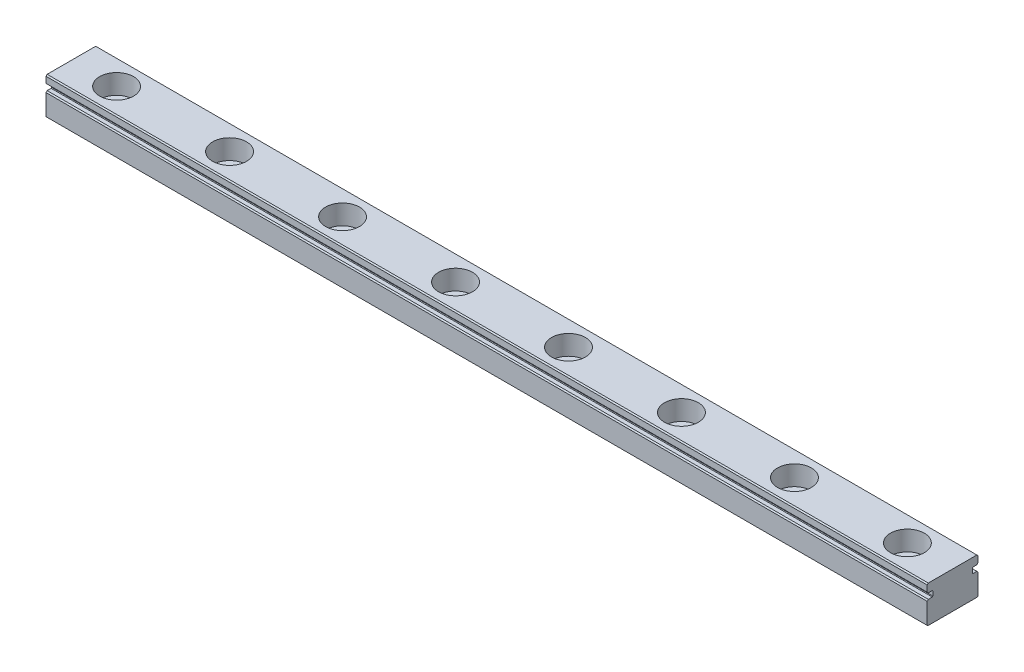
from build123d import *

# Parameters (mm, degrees)
EXTRUDE_1_DEPTH     = 156
CHAMFER_1_SIZE      = 0.2
CHAMFER_2_SIZE      = 0.1
SKETCH_2_R          = 1.6
CUT_EXTRUDE_1_DEPTH = 6.5
SKETCH_3_R          = 3
CUT_EXTRUDE_2_DEPTH = 3.5


with BuildPart() as part:
    # 草图1 → 凸台-拉伸1 (new body)
    with BuildSketch(Plane(origin=(0, 0, 0), x_dir=(0, 0, -1), z_dir=(1, 0, 0))):
        Polygon((-4.5, 1.5), (-3.5, 1.5), (-3.5, 0.5), (-4.5, 0.5), (-4.5, -3.5), (4.5, -3.5), (4.5, 0.5), (3.5, 0.5), (3.5, 1.5), (4.5, 1.5), (4.5, 3), (-4.5, 3), align=None)
    extrude(amount=EXTRUDE_1_DEPTH)

    # 倒角1
    chamfer_1_edges = [part.edges().sort_by_distance(p)[0] for p in [
        (78, 1.5, -4.5),
        (78, 0.5, -4.5),
        (78, 0.5, 4.5),
        (78, 1.5, 4.5),
        (78, 3, 4.5),
        (78, 3, -4.5),
    ]]
    chamfer(chamfer_1_edges, length=CHAMFER_1_SIZE)

    # 倒角2
    chamfer_2_edges = [part.edges().sort_by_distance(p)[0] for p in [
        (78, 1.5, -3.5),
        (78, 0.5, -3.5),
        (78, -3.5, -4.5),
        (78, -3.5, 4.5),
        (78, 0.5, 3.5),
        (78, 1.5, 3.5),
    ]]
    chamfer(chamfer_2_edges, length=CHAMFER_2_SIZE)

    # 草图2 → 切除-拉伸1 (cut)
    with BuildSketch(Plane(origin=(0, 3, 0), x_dir=(1, 0, 0), z_dir=(0, 1, 0))):
        with Locations(Location((8, 0, 0), (0, 0, 270))):
            Circle(SKETCH_2_R)
        with Locations(Location((28, 0, 0), (0, 0, 270))):
            Circle(SKETCH_2_R)
        with Locations(Location((48, 0, 0), (0, 0, 270))):
            Circle(SKETCH_2_R)
        with Locations(Location((68, 0, 0), (0, 0, 270))):
            Circle(SKETCH_2_R)
        with Locations(Location((88, 0, 0), (0, 0, 270))):
            Circle(SKETCH_2_R)
        with Locations(Location((108, 0, 0), (0, 0, 270))):
            Circle(SKETCH_2_R)
        with Locations(Location((128, 0, 0), (0, 0, 270))):
            Circle(SKETCH_2_R)
        with Locations(Location((148, 0, 0), (0, 0, 270))):
            Circle(SKETCH_2_R)
    extrude(amount=-CUT_EXTRUDE_1_DEPTH, mode=Mode.SUBTRACT)

    # 草图3 → 切除-拉伸2 (cut)
    with BuildSketch(Plane(origin=(0, 3, 0), x_dir=(1, 0, 0), z_dir=(0, 1, 0))):
        with Locations(Location((8, 0, 0), (0, 0, 270))):
            Circle(SKETCH_3_R)
        with Locations(Location((28, 0, 0), (0, 0, 270))):
            Circle(SKETCH_3_R)
        with Locations(Location((48, 0, 0), (0, 0, 270))):
            Circle(SKETCH_3_R)
        with Locations(Location((68, 0, 0), (0, 0, 270))):
            Circle(SKETCH_3_R)
        with Locations(Location((88, 0, 0), (0, 0, 270))):
            Circle(SKETCH_3_R)
        with Locations(Location((108, 0, 0), (0, 0, 270))):
            Circle(SKETCH_3_R)
        with Locations(Location((128, 0, 0), (0, 0, 270))):
            Circle(SKETCH_3_R)
        with Locations(Location((148, 0, 0), (0, 0, 270))):
            Circle(SKETCH_3_R)
    extrude(amount=-CUT_EXTRUDE_2_DEPTH, mode=Mode.SUBTRACT)


solid = part.part
